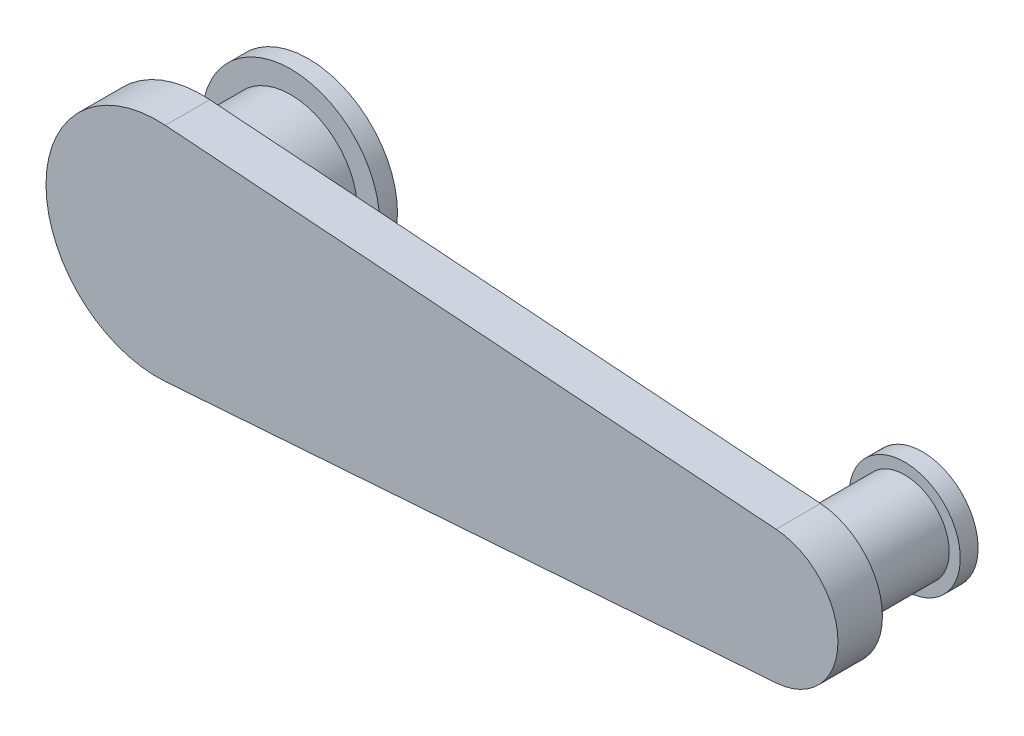
from build123d import *

# Parameters (mm, degrees)
BOSS_EXTRUDE1_DEPTH = 25
SKETCH2_R           = 75
SKETCH2_R_2         = 50
BOSS_EXTRUDE2_DEPTH = 100
SKETCH3_R           = 62.5
SKETCH3_R_2         = 100
BOSS_EXTRUDE3_DEPTH = 20


with BuildPart() as part:
    # Sketch1 → Boss-Extrude1 (new, symmetric)
    with BuildSketch(Plane.XY):
        with BuildLine():
            ThreePointArc((-215, 0), (-290, 75), (-365, 0))
            Line((-365, 0), (-215, 0))
        make_face()
        with BuildLine():
            Line((-215, 0), (-365, 0))
            ThreePointArc((-365, 0), (-290, -75), (-215, 0))
        make_face()
        with BuildLine():
            Line((405.434782609, 74.802828409), (-280.942028986, 124.671380682))
            ThreePointArc((-280.942028986, 124.671380682), (-375.125653076, 91.534819541), (-415, 0))
            Line((-415, 0), (-365, 0))
            ThreePointArc((-365, 0), (-290, 75), (-215, 0))
            Line((-215, 0), (350, 0))
            ThreePointArc((350, 0), (400, 50), (450, 0))
            Line((450, 0), (475, 0))
            ThreePointArc((475, 0), (454.920891725, 51.075391846), (405.434782609, 74.802828409))
        make_face()
        with BuildLine():
            Line((-365, 0), (-415, 0))
            ThreePointArc((-415, 0), (-375.125653076, -91.534819541), (-280.942028986, -124.671380682))
            Line((-280.942028986, -124.671380682), (405.434782609, -74.802828409))
            ThreePointArc((405.434782609, -74.802828409), (454.920891725, -51.075391846), (475, 0))
            Line((475, 0), (450, 0))
            ThreePointArc((450, 0), (400, -50), (350, 0))
            Line((350, 0), (-215, 0))
            ThreePointArc((-215, 0), (-290, -75), (-365, 0))
        make_face()
        with BuildLine():
            ThreePointArc((350, 0), (400, -50), (450, 0))
            Line((450, 0), (350, 0))
        make_face()
        with BuildLine():
            Line((350, 0), (450, 0))
            ThreePointArc((450, 0), (400, 50), (350, 0))
        make_face()
    extrude(amount=BOSS_EXTRUDE1_DEPTH, both=True)

    # Sketch2 → Boss-Extrude2 (add)
    with BuildSketch(Plane(origin=(0, 0, -25), x_dir=(-1, 0, 0), z_dir=(0, 0, -1))):
        with Locations(Location((290, 0, 0), (0, 0, 180))):
            Circle(SKETCH2_R)
        with Locations(Location((-400, 0, 0), (0, 0, 180))):
            Circle(SKETCH2_R_2)
    extrude(amount=BOSS_EXTRUDE2_DEPTH)

    # Sketch3 → Boss-Extrude3 (add)
    with BuildSketch(Plane(origin=(0, 0, -125), x_dir=(-1, 0, 0), z_dir=(0, 0, -1))):
        with Locations((-400, 0)):
            Circle(SKETCH3_R)
        with Locations((290, 0)):
            Circle(SKETCH3_R_2)
    extrude(amount=BOSS_EXTRUDE3_DEPTH)


solid = part.part
